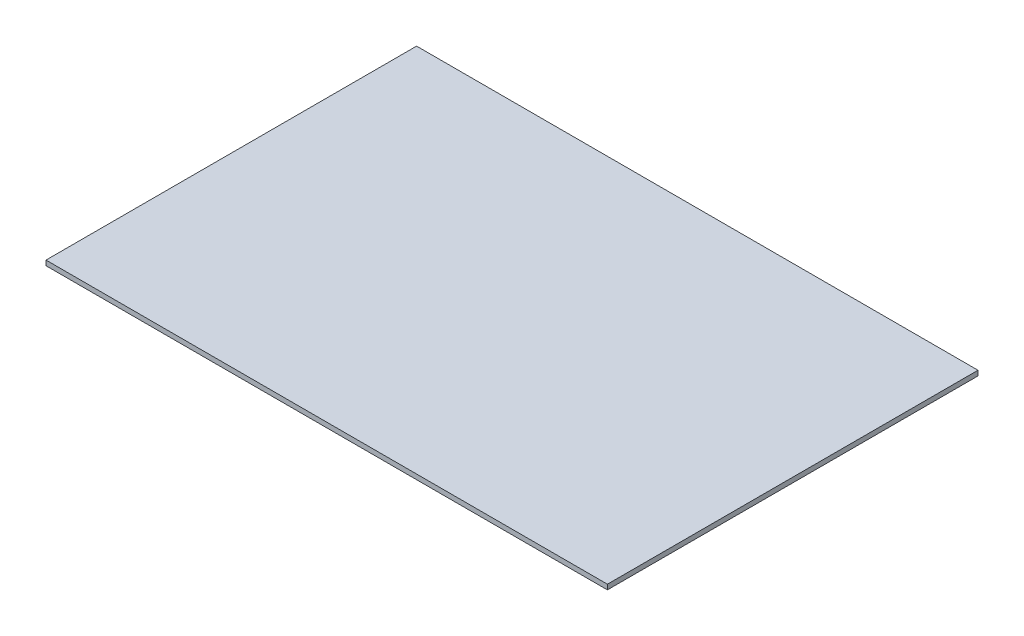
from build123d import *

# Parameters (mm, degrees)
SKETCH2_W           = 22.72371994
SKETCH2_H           = 15
BOSS_EXTRUDE1_DEPTH = 0.2


with BuildPart() as part:
    # Sketch2 → Boss-Extrude1 (new body)
    with BuildSketch(Plane(origin=(0, 0, 0), x_dir=(1, 0, 0), z_dir=(0, 1, 0))):
        with Locations((11.36185997, 7.5)):
            Rectangle(SKETCH2_W, SKETCH2_H)
    extrude(amount=BOSS_EXTRUDE1_DEPTH)


solid = part.part
